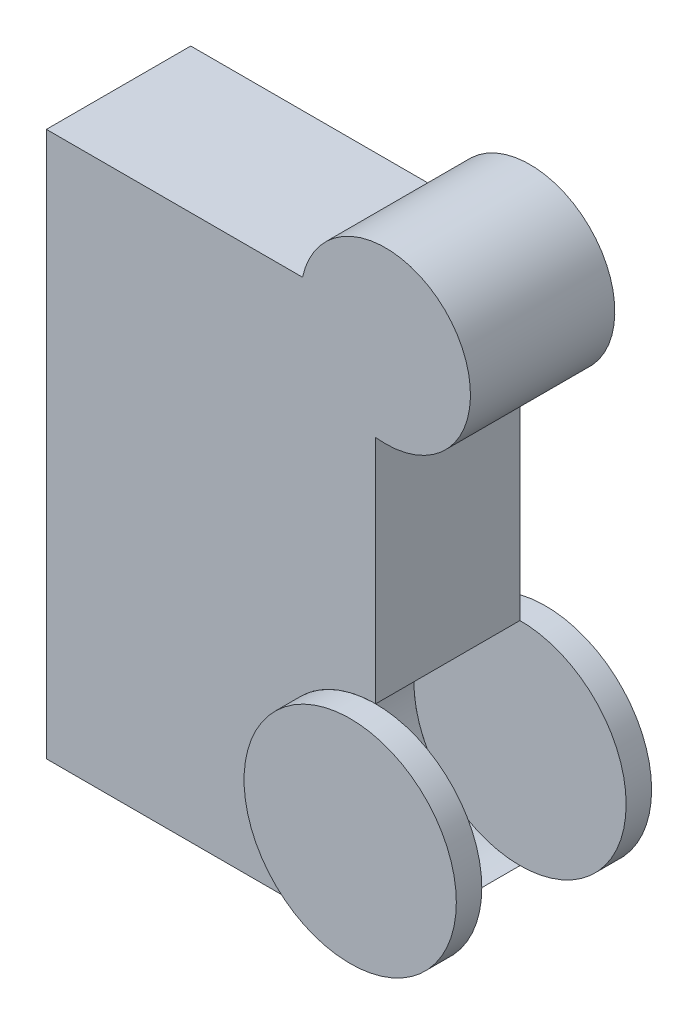
from build123d import *

# Parameters (mm, degrees)
SALIENTE_EXTRUIR1_DEPTH = 8.5
CROQUIS2_R              = 12.5
SALIENTE_EXTRUIR2_DEPTH = 3


with BuildPart() as part:
    # Croquis1 → Saliente-Extruir1 (new, symmetric)
    with BuildSketch(Plane.XY):
        with BuildLine():
            Line((-20, 33.113225815), (-20, -31.092697389))
            Line((-20, -31.092697389), (18.77962453, -31.092697389))
            ThreePointArc((18.77962453, -31.092697389), (6.27962453, -18.592697389), (18.77962453, -6.092697389))
            Line((18.77962453, -6.092697389), (18.77962453, 21.074454159))
            ThreePointArc((18.77962453, 21.074454159), (28.078113499, 36.823933556), (10.168935783, 33.113225815))
            Line((10.168935783, 33.113225815), (-20, 33.113225815))
        make_face()
    extrude(amount=SALIENTE_EXTRUIR1_DEPTH, both=True)


with BuildPart() as body_2:
    # Croquis2 → Saliente-Extruir2 (new body)
    with BuildSketch(Plane.XY.offset(8.5)):
        with Locations((18.77962453, -18.592697389)):
            Circle(CROQUIS2_R)
    extrude(amount=SALIENTE_EXTRUIR2_DEPTH)


with BuildPart() as body_3:
    # Simetría2: mirrored copy
    add(body_2.part.mirror(Plane(origin=(0, 0, 0), x_dir=(1, 0, 0), z_dir=(0, 0, -1))))


solid = Compound([part.part, body_2.part, body_3.part])
